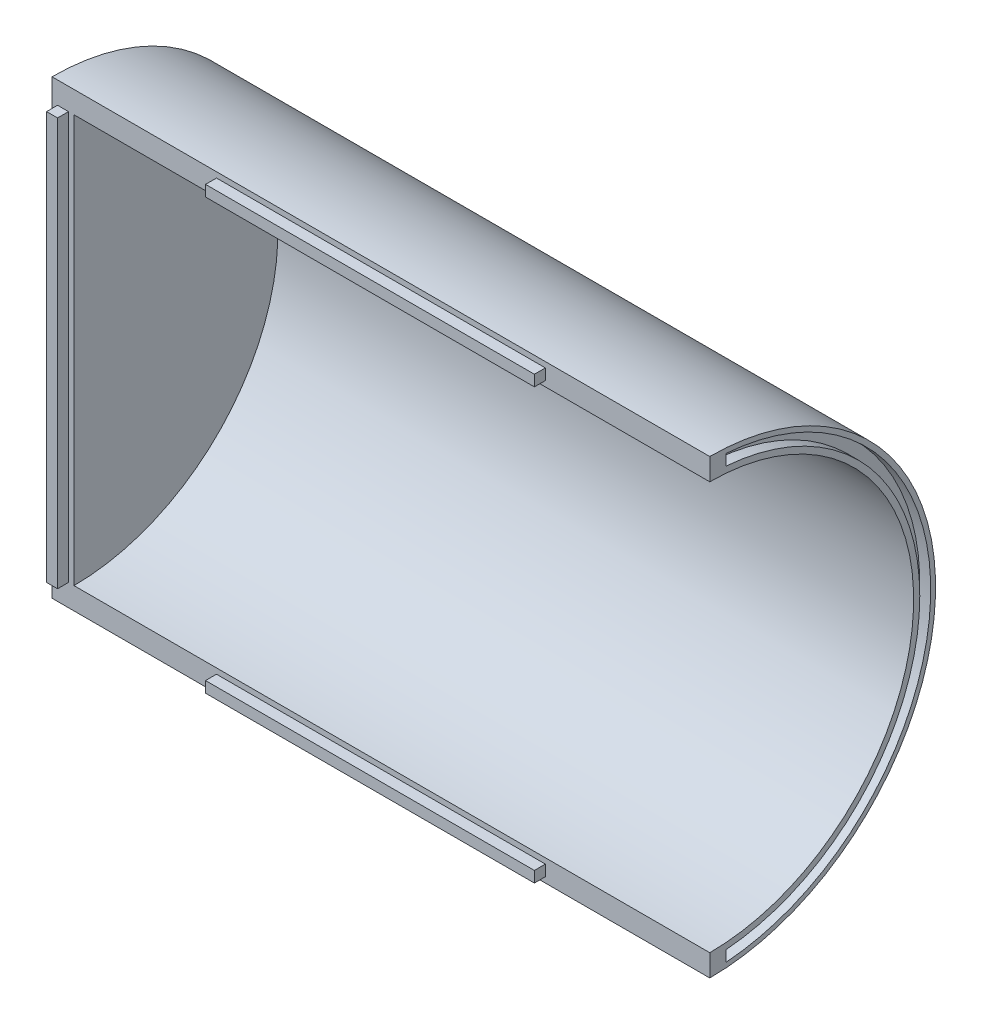
from build123d import *

# Parameters (mm, degrees)
REVOLVE1_ANGLE      = 180
SKETCH4_W           = 2.54
SKETCH4_H           = 94.488
SKETCH4_W_2         = 76.2
SKETCH4_H_2         = 2.54
BOSS_EXTRUDE1_DEPTH = 2.54
CUT_EXTRUDE1_DEPTH  = 2.54


with BuildPart() as part:
    # Sketch1 → Revolve1 (revolve)
    with BuildSketch(Plane.XY):
        Polygon((0, 0), (0, 52.324), (152.4, 52.324), (152.4, 47.244), (5.08, 47.244), (5.08, 0), align=None)
    revolve(axis=Axis((5.08, 0, 0), (-1, 0, 0)), revolution_arc=REVOLVE1_ANGLE)

    # Sketch4 → Boss-Extrude1 (add)
    with BuildSketch(Plane.XY):
        with Locations((2.54, 0)):
            Rectangle(SKETCH4_W, SKETCH4_H)
        with Locations((76.2, 49.784)):
            Rectangle(SKETCH4_W_2, SKETCH4_H_2)
        with Locations((76.2, -49.784)):
            Rectangle(SKETCH4_W_2, SKETCH4_H_2)
    extrude(amount=BOSS_EXTRUDE1_DEPTH)

    # Sketch5 → Cut-Extrude1 (cut)
    with BuildSketch(Plane(origin=(152.4, 0, 0), x_dir=(0, 0, -1), z_dir=(1, 0, 0))):
        with BuildLine():
            Line((3.81, 51.054), (3.81, 48.514))
            ThreePointArc((3.81, 48.514), (48.663377359, 0), (3.81, -48.514))
            Line((3.81, -48.514), (3.81, -51.054))
            ThreePointArc((3.81, -51.054), (51.195966794, 0), (3.81, 51.054))
        make_face()
    extrude(amount=-CUT_EXTRUDE1_DEPTH, mode=Mode.SUBTRACT)


solid = part.part
